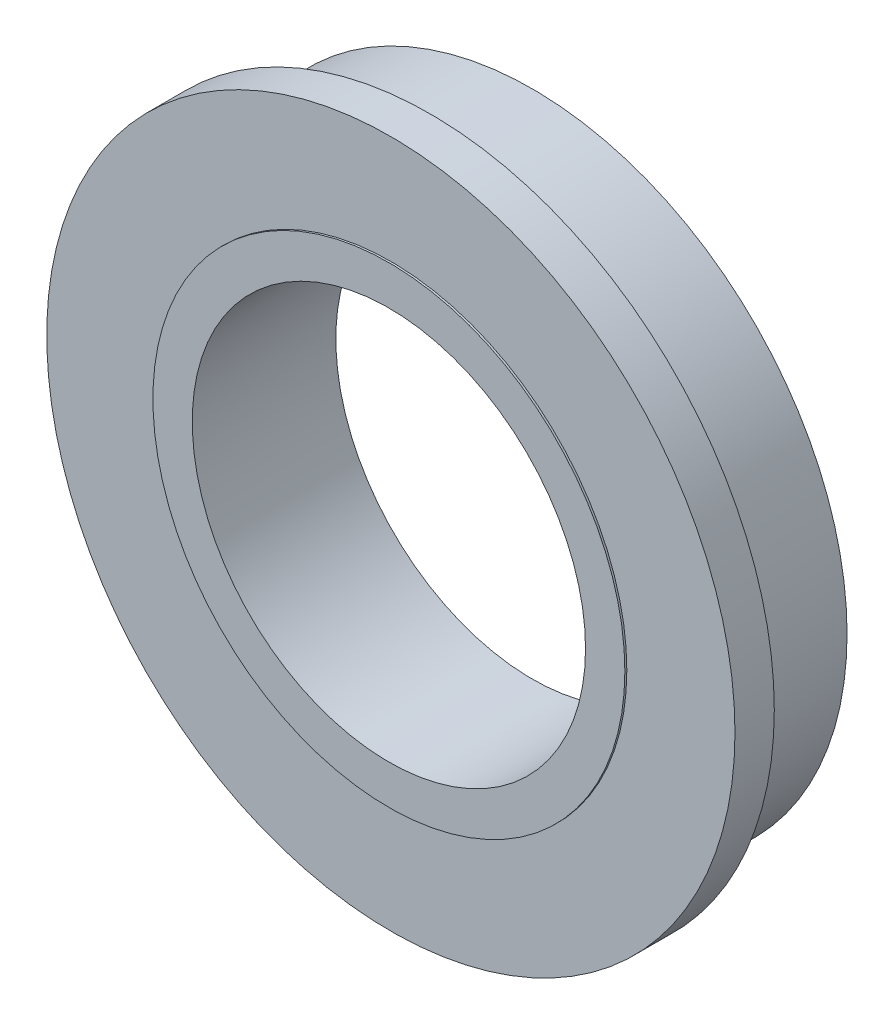
from build123d import *

# Parameters (mm, degrees)
SKETCH1_R           = 16
SKETCH1_R_2         = 10
BOSS_EXTRUDE1_DEPTH = 5.2
SKETCH2_R           = 17.5
SKETCH2_R_2         = 10
BOSS_EXTRUDE2_DEPTH = 2
SKETCH3_R           = 12
SKETCH3_R_2         = 10
BOSS_EXTRUDE3_DEPTH = 0.1


with BuildPart() as part:
    # Sketch1 → Boss-Extrude1 (new body)
    with BuildSketch(Plane.XY):
        Circle(SKETCH1_R)
        Circle(SKETCH1_R_2, mode=Mode.SUBTRACT)
    extrude(amount=BOSS_EXTRUDE1_DEPTH)

    # Sketch2 → Boss-Extrude2 (add)
    with BuildSketch(Plane.XY.offset(5.2)):
        Circle(SKETCH2_R)
        Circle(SKETCH2_R_2, mode=Mode.SUBTRACT)
    extrude(amount=BOSS_EXTRUDE2_DEPTH)

    # Sketch3 → Boss-Extrude3 (add)
    with BuildSketch(Plane.XY.offset(7.2)):
        Circle(SKETCH3_R)
        Circle(SKETCH3_R_2, mode=Mode.SUBTRACT)
    extrude(amount=BOSS_EXTRUDE3_DEPTH)


solid = part.part
